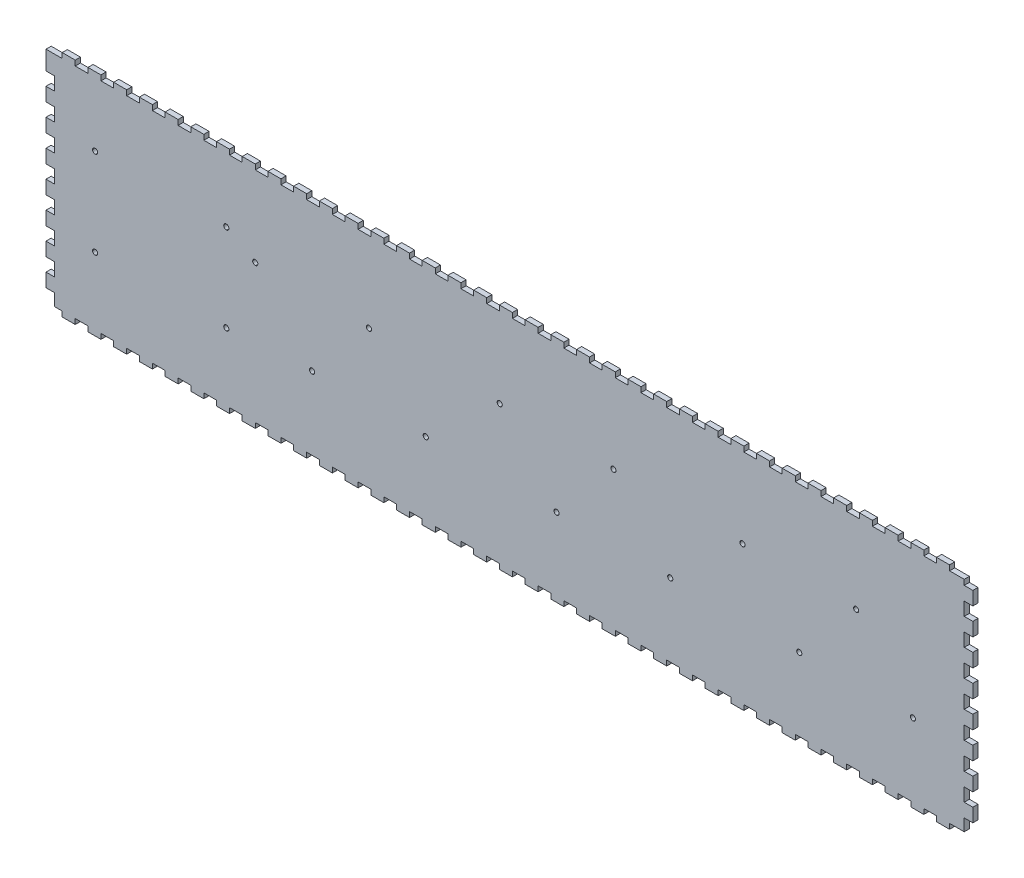
from build123d import *

# Parameters (mm, degrees)
BOSS_EXTRUDE1_DEPTH = 3


with BuildPart() as part:
    # Sketch1 → Boss-Extrude1 (new body)
    with BuildSketch(Plane.XY):
        Polygon((533.360201, 7.715942), (533.360201, 0.710022), (524.841634, 0.710022), (524.841634, -2.29), (517.27314, -2.29), (517.27314, 0.710022), (509.904684, 0.710022), (509.904684, -2.29), (502.33619, -2.29), (502.33619, 0.710022), (494.967706, 0.710022), (494.967706, -2.29), (487.471629826, -2.29), (487.326794174, 0.710022), (480.030757, 0.710022), (480.030757, -2.29), (472.462262, -2.29), (472.462262, 0.710022), (465.093779, 0.710022), (465.093779, -2.29), (457.525651, -2.29), (457.525651, 0.710022), (450.157167, 0.710022), (450.157167, -2.29), (442.588673, -2.29), (442.588673, 0.710022), (435.220218, 0.710022), (435.220218, -2.29), (427.651723, -2.29), (427.651723, 0.710022), (420.28324, 0.710022), (420.28324, -2.29), (412.714745, -2.29), (412.714745, 0.710022), (405.34629, 0.710022), (405.34629, -2.29), (397.777795, -2.29), (397.777795, 0.710022), (390.409312, 0.710022), (390.409312, -2.29), (382.840817, -2.29), (382.840817, 0.710022), (375.472701, 0.710022), (375.472701, -2.29), (367.904206, -2.29), (367.904206, 0.710022), (360.535751, 0.710022), (360.535751, -2.29), (352.967257, -2.29), (352.967257, 0.710022), (345.598773, 0.710022), (345.598773, -2.29), (338.030279, -2.29), (338.030279, 0.710022), (330.661823, 0.710022), (330.661823, -2.29), (323.093329, -2.29), (323.093329, 0.710022), (315.724845, 0.710022), (315.724845, -2.29), (308.156351, -2.29), (308.156351, 0.710022), (300.787895, 0.710022), (300.787895, -2.29), (293.21974, -2.29), (293.21974, 0.710022), (285.851284, 0.710022), (285.851284, -2.29), (278.28279, -2.29), (278.28279, 0.710022), (270.914306, 0.710022), (270.914306, -2.29), (263.345812, -2.29), (263.345812, 0.710022), (255.977357, 0.710022), (255.977357, -2.29), (248.408862, -2.29), (248.408862, 0.710022), (241.040379, 0.710022), (241.040379, -2.29), (233.471884, -2.29), (233.471884, 0.710022), (226.103429, 0.710022), (226.103429, -2.29), (218.534934, -2.29), (218.534934, 0.710022), (211.166451, 0.710022), (211.166451, -2.29), (203.598323, -2.29), (203.598323, 0.710022), (196.22984, 0.710022), (196.22984, -2.29), (188.661345, -2.29), (188.661345, 0.710022), (181.29289, 0.710022), (181.29289, -2.29), (173.724395, -2.29), (173.724395, 0.710022), (166.355912, 0.710022), (166.355912, -2.29), (158.787417, -2.29), (158.787417, 0.710022), (151.418962, 0.710022), (151.418962, -2.29), (143.850468, -2.29), (143.850468, 0.710022), (136.481984, 0.710022), (136.481984, -2.29), (128.913851, -2.29), (128.913851, 0.710022), (121.545381, 0.710022), (121.545381, -2.29), (113.976887, -2.29), (113.976887, 0.710022), (106.608418, 0.710022), (106.608418, -2.29), (99.039923, -2.29), (99.039923, 0.710022), (91.671454, 0.710022), (91.671454, -2.29), (84.102959, -2.29), (84.102959, 0.710022), (76.734526, 0.710022), (76.734526, -2.29), (69.166066, -2.29), (69.166066, 0.710022), (61.79763, 0.710022), (61.79763, -2.29), (54.229173, -2.29), (54.229173, 0.710022), (46.860703, 0.710022), (46.860703, -2.29), (39.292279, -2.29), (39.292279, 0.710022), (31.92381, 0.710022), (31.92381, -2.29), (24.355349, -2.29), (24.355349, 0.710022), (16.986916, 0.710022), (16.986916, -2.29), (9.418456, -2.29), (9.418456, 0.710022), (5.000021, 0.710022), (5.000021, 7.715942), (0, 7.715942), (0, 15.606102), (5.000021, 15.606102), (5.000021, 23.296288), (0, 23.296288), (0, 31.186448), (5.000021, 31.186448), (5.000021, 38.876637), (0, 38.876637), (0, 46.766797), (5.000021, 46.766797), (5.000021, 54.457019), (0, 54.457019), (0, 62.347179), (5.000021, 62.347188), (5.000021, 70.037365), (0, 70.037365), (0, 77.927525), (5.000021, 77.927525), (5.000021, 85.617711), (0, 85.617711), (0, 93.507905), (5.000021, 93.507905), (5.000021, 101.198094), (0, 101.198094), (0, 109.088253), (5.000021, 109.088253), (5.000021, 116.778442), (0, 116.778442), (0, 127.748999), (9.418456, 127.748999), (9.418456, 130.749021), (16.986916, 130.749021), (16.986916, 127.748999), (24.355349, 127.748999), (24.355349, 130.749021), (31.92381, 130.749021), (31.92381, 127.748999), (39.292279, 127.748999), (39.292279, 130.749021), (46.860703, 130.749021), (46.860703, 127.748999), (54.229173, 127.748999), (54.229173, 130.749021), (61.79763, 130.749021), (61.79763, 127.748999), (69.166066, 127.748999), (69.166066, 130.749021), (76.734526, 130.749021), (76.734526, 127.748999), (84.102959, 127.748999), (84.102959, 130.749021), (91.671454, 130.749021), (91.671454, 127.748999), (99.039923, 127.748999), (99.039923, 130.749021), (106.608418, 130.749021), (106.608418, 127.748999), (113.976887, 127.748999), (113.976887, 130.749021), (121.545381, 130.749021), (121.545381, 127.748999), (128.913851, 127.748999), (128.913851, 130.749021), (136.481984, 130.749021), (136.481984, 127.748999), (143.850468, 127.748999), (143.850468, 130.749021), (151.418962, 130.749021), (151.418962, 127.748999), (158.787417, 127.748999), (158.787417, 130.749021), (166.355912, 130.749021), (166.355912, 127.748999), (173.724395, 127.748999), (173.724395, 130.749021), (181.29289, 130.749021), (181.29289, 127.748999), (188.661345, 127.748999), (188.661345, 130.749021), (196.22984, 130.749021), (196.22984, 127.748999), (203.598323, 127.748999), (203.598323, 130.749021), (211.166451, 130.749021), (211.166451, 127.748999), (218.534934, 127.748999), (218.534934, 130.749021), (226.103429, 130.749021), (226.103429, 127.748999), (233.471884, 127.748999), (233.471884, 130.749021), (241.040379, 130.749021), (241.040379, 127.748999), (248.408862, 127.748999), (248.408862, 130.749021), (255.977357, 130.749021), (255.977357, 127.748999), (263.345812, 127.748999), (263.345812, 130.749021), (270.914306, 130.749021), (270.914306, 127.748999), (278.28279, 127.748999), (278.28279, 130.749021), (285.851284, 130.749021), (285.851284, 127.748999), (293.21974, 127.748999), (293.21974, 130.749021), (300.787895, 130.749021), (300.787895, 127.748999), (308.156351, 127.748999), (308.156351, 130.749021), (315.724845, 130.749021), (315.724845, 127.748999), (323.093329, 127.748999), (323.093329, 130.749021), (330.661823, 130.749021), (330.661823, 127.748999), (338.030279, 127.748999), (338.030279, 130.749021), (345.598773, 130.749021), (345.598773, 127.748999), (352.967257, 127.748999), (352.967257, 130.749021), (360.535751, 130.749021), (360.535751, 127.748999), (367.904206, 127.748999), (367.904206, 130.749021), (375.472701, 130.749021), (375.472701, 127.748999), (382.840817, 127.748999), (382.840817, 130.749021), (390.409312, 130.749021), (390.409312, 127.748999), (397.777795, 127.748999), (397.777795, 130.749021), (405.34629, 130.749021), (405.34629, 127.748999), (412.714745, 127.748999), (412.714745, 130.749021), (420.28324, 130.749021), (420.28324, 127.748999), (427.651723, 127.748999), (427.651723, 130.749021), (435.220218, 130.749021), (435.220218, 127.748999), (442.588673, 127.748999), (442.588673, 130.749021), (450.157167, 130.749021), (450.157167, 127.748999), (457.525651, 127.748999), (457.525651, 130.749021), (465.093779, 130.749021), (465.093779, 127.748999), (472.462262, 127.748999), (472.462262, 130.749021), (480.030757, 130.749021), (480.030757, 127.748999), (487.399212, 127.748999), (487.399212, 130.749021), (494.967706, 130.749021), (494.967706, 127.748999), (502.33619, 127.748999), (502.33619, 130.749021), (509.904684, 130.749021), (509.904684, 127.748999), (517.27314, 127.748999), (517.27314, 130.749021), (524.841634, 130.749021), (524.841634, 127.748999), (533.360201, 127.748999), (533.360201, 124.669342), (538.359429, 124.669342), (538.359429, 116.781877), (533.360201, 116.781877), (533.360201, 109.094314), (538.359853, 109.094314), (538.359853, 101.206848), (533.360201, 101.206848), (533.360201, 93.505726), (538.359853, 93.505726), (538.359853, 85.615733), (533.360201, 85.615733), (533.360201, 77.925739), (538.359853, 77.925739), (538.359853, 70.035782), (533.360201, 70.035782), (533.360201, 62.345791), (538.359853, 62.345791), (538.359853, 54.455831), (533.360201, 54.455831), (533.360201, 46.765803), (538.359853, 46.765803), (538.359853, 38.875844), (533.360201, 38.875844), (533.360201, 31.185853), (538.359853, 31.185853), (538.359853, 23.295893), (533.360201, 23.295893), (533.360201, 15.605902), (538.359853, 15.605902), (538.359853, 7.715942), align=None)
        with BuildLine():
            add(Edge.make_bspline(
                [(502.099744, 43.109005), (502.099744, 42.280683), (502.77108, 41.608994), (503.599755, 41.608994)],
                knots=[0, 0, 0, 0, 1, 1, 1, 1], degree=3))
            add(Edge.make_bspline(
                [(503.599755, 41.608994), (504.427725, 41.608994), (505.099766, 42.280683), (505.099766, 43.109005)],
                knots=[0, 0, 0, 0, 1, 1, 1, 1], degree=3))
            add(Edge.make_bspline(
                [(505.099766, 43.109005), (505.099766, 43.93768), (504.427725, 44.609016), (503.599755, 44.609016)],
                knots=[0, 0, 0, 0, 1, 1, 1, 1], degree=3))
            add(Edge.make_bspline(
                [(503.599755, 44.609016), (502.77108, 44.609016), (502.099744, 43.93768), (502.099744, 43.109005)],
                knots=[0, 0, 0, 0, 1, 1, 1, 1], degree=3))
        make_face(mode=Mode.SUBTRACT)
        with BuildLine():
            add(Edge.make_bspline(
                [(469.079391, 81.209005), (469.079391, 80.380683), (469.750727, 79.708994), (470.579402, 79.708994)],
                knots=[0, 0, 0, 0, 1, 1, 1, 1], degree=3))
            add(Edge.make_bspline(
                [(470.579402, 79.708994), (471.408077, 79.708994), (472.079414, 80.380683), (472.079414, 81.209005)],
                knots=[0, 0, 0, 0, 1, 1, 1, 1], degree=3))
            add(Edge.make_bspline(
                [(472.079414, 81.209005), (472.079414, 82.03768), (471.408077, 82.709016), (470.579402, 82.709016)],
                knots=[0, 0, 0, 0, 1, 1, 1, 1], degree=3))
            add(Edge.make_bspline(
                [(470.579402, 82.709016), (469.750727, 82.709016), (469.079391, 82.03768), (469.079391, 81.209005)],
                knots=[0, 0, 0, 0, 1, 1, 1, 1], degree=3))
        make_face(mode=Mode.SUBTRACT)
        with BuildLine():
            add(Edge.make_bspline(
                [(436.059779, 43.109005), (436.059779, 42.280683), (436.731115, 41.608994), (437.559438, 41.608994)],
                knots=[0, 0, 0, 0, 1, 1, 1, 1], degree=3))
            add(Edge.make_bspline(
                [(437.559438, 41.608994), (438.388113, 41.608994), (439.059449, 42.280683), (439.059449, 43.109005)],
                knots=[0, 0, 0, 0, 1, 1, 1, 1], degree=3))
            add(Edge.make_bspline(
                [(439.059449, 43.109005), (439.059449, 43.93768), (438.388113, 44.609016), (437.559438, 44.609016)],
                knots=[0, 0, 0, 0, 1, 1, 1, 1], degree=3))
            add(Edge.make_bspline(
                [(437.559438, 44.609016), (436.731115, 44.609016), (436.059779, 43.93768), (436.059779, 43.109005)],
                knots=[0, 0, 0, 0, 1, 1, 1, 1], degree=3))
        make_face(mode=Mode.SUBTRACT)
        with BuildLine():
            add(Edge.make_bspline(
                [(403.039427, 81.209005), (403.039427, 80.380683), (403.710763, 79.708994), (404.539438, 79.708994)],
                knots=[0, 0, 0, 0, 1, 1, 1, 1], degree=3))
            add(Edge.make_bspline(
                [(404.539438, 79.708994), (405.368113, 79.708994), (406.039449, 80.380683), (406.039449, 81.209005)],
                knots=[0, 0, 0, 0, 1, 1, 1, 1], degree=3))
            add(Edge.make_bspline(
                [(406.039449, 81.209005), (406.039449, 82.03768), (405.368113, 82.709016), (404.539438, 82.709016)],
                knots=[0, 0, 0, 0, 1, 1, 1, 1], degree=3))
            add(Edge.make_bspline(
                [(404.539438, 82.709016), (403.710763, 82.709016), (403.039427, 82.03768), (403.039427, 81.209005)],
                knots=[0, 0, 0, 0, 1, 1, 1, 1], degree=3))
        make_face(mode=Mode.SUBTRACT)
        with BuildLine():
            add(Edge.make_bspline(
                [(361.099822, 43.109005), (361.099822, 42.280683), (361.771158, 41.608994), (362.599833, 41.608994)],
                knots=[0, 0, 0, 0, 1, 1, 1, 1], degree=3))
            add(Edge.make_bspline(
                [(362.599833, 41.608994), (363.427802, 41.608994), (364.099844, 42.280683), (364.099844, 43.109005)],
                knots=[0, 0, 0, 0, 1, 1, 1, 1], degree=3))
            add(Edge.make_bspline(
                [(364.099844, 43.109005), (364.099844, 43.93768), (363.427802, 44.609016), (362.599833, 44.609016)],
                knots=[0, 0, 0, 0, 1, 1, 1, 1], degree=3))
            add(Edge.make_bspline(
                [(362.599833, 44.609016), (361.771158, 44.609016), (361.099822, 43.93768), (361.099822, 43.109005)],
                knots=[0, 0, 0, 0, 1, 1, 1, 1], degree=3))
        make_face(mode=Mode.SUBTRACT)
        with BuildLine():
            add(Edge.make_bspline(
                [(328.079469, 81.209005), (328.079469, 80.380683), (328.750805, 79.708994), (329.57948, 79.708994)],
                knots=[0, 0, 0, 0, 1, 1, 1, 1], degree=3))
            add(Edge.make_bspline(
                [(329.57948, 79.708994), (330.408155, 79.708994), (331.079491, 80.380683), (331.079491, 81.209005)],
                knots=[0, 0, 0, 0, 1, 1, 1, 1], degree=3))
            add(Edge.make_bspline(
                [(331.079491, 81.209005), (331.079491, 82.03768), (330.408155, 82.709016), (329.57948, 82.709016)],
                knots=[0, 0, 0, 0, 1, 1, 1, 1], degree=3))
            add(Edge.make_bspline(
                [(329.57948, 82.709016), (328.750805, 82.709016), (328.079469, 82.03768), (328.079469, 81.209005)],
                knots=[0, 0, 0, 0, 1, 1, 1, 1], degree=3))
        make_face(mode=Mode.SUBTRACT)
        with BuildLine():
            add(Edge.make_bspline(
                [(295.059465, 43.109005), (295.059465, 42.280683), (295.731154, 41.608994), (296.559476, 41.608994)],
                knots=[0, 0, 0, 0, 1, 1, 1, 1], degree=3))
            add(Edge.make_bspline(
                [(296.559476, 41.608994), (297.388155, 41.608994), (298.059491, 42.280683), (298.059491, 43.109005)],
                knots=[0, 0, 0, 0, 1, 1, 1, 1], degree=3))
            add(Edge.make_bspline(
                [(298.059491, 43.109005), (298.059491, 43.93768), (297.388155, 44.609016), (296.559476, 44.609016)],
                knots=[0, 0, 0, 0, 1, 1, 1, 1], degree=3))
            add(Edge.make_bspline(
                [(296.559476, 44.609016), (295.731154, 44.609016), (295.059465, 43.93768), (295.059465, 43.109005)],
                knots=[0, 0, 0, 0, 1, 1, 1, 1], degree=3))
        make_face(mode=Mode.SUBTRACT)
        with BuildLine():
            add(Edge.make_bspline(
                [(262.039426, 81.209005), (262.039426, 80.380683), (262.710798, 79.708994), (263.539402, 79.708994)],
                knots=[0, 0, 0, 0, 1, 1, 1, 1], degree=3))
            add(Edge.make_bspline(
                [(263.539402, 79.708994), (264.368042, 79.708994), (265.039413, 80.380683), (265.039413, 81.209005)],
                knots=[0, 0, 0, 0, 1, 1, 1, 1], degree=3))
            add(Edge.make_bspline(
                [(265.039413, 81.209005), (265.039413, 82.03768), (264.368042, 82.709016), (263.539402, 82.709016)],
                knots=[0, 0, 0, 0, 1, 1, 1, 1], degree=3))
            add(Edge.make_bspline(
                [(263.539402, 82.709016), (262.710798, 82.709016), (262.039426, 82.03768), (262.039426, 81.209005)],
                knots=[0, 0, 0, 0, 1, 1, 1, 1], degree=3))
        make_face(mode=Mode.SUBTRACT)
        with BuildLine():
            add(Edge.make_bspline(
                [(28.539436, 89.179434), (27.710761, 89.179434), (27.039425, 89.85077), (27.039425, 90.679092)],
                knots=[0, 0, 0, 0, 1, 1, 1, 1], degree=3))
            add(Edge.make_bspline(
                [(27.039425, 90.679092), (27.039425, 91.507767), (27.710761, 92.179103), (28.539436, 92.179103)],
                knots=[0, 0, 0, 0, 1, 1, 1, 1], degree=3))
            add(Edge.make_bspline(
                [(28.539436, 92.179103), (29.368111, 92.179103), (30.039447, 91.507767), (30.039447, 90.679092)],
                knots=[0, 0, 0, 0, 1, 1, 1, 1], degree=3))
            add(Edge.make_bspline(
                [(30.039447, 90.679092), (30.039447, 89.85077), (29.368111, 89.179434), (28.539436, 89.179434)],
                knots=[0, 0, 0, 0, 1, 1, 1, 1], degree=3))
        make_face(mode=Mode.SUBTRACT)
        with BuildLine():
            add(Edge.make_bspline(
                [(28.539436, 38.37834), (27.710761, 38.37834), (27.039425, 39.048618), (27.039425, 39.877646)],
                knots=[0, 0, 0, 0, 1, 1, 1, 1], degree=3))
            add(Edge.make_bspline(
                [(27.039425, 39.877646), (27.039425, 40.706673), (27.710761, 41.380479), (28.539436, 41.380479)],
                knots=[0, 0, 0, 0, 1, 1, 1, 1], degree=3))
            add(Edge.make_bspline(
                [(28.539436, 41.380479), (29.368111, 41.380479), (30.039447, 40.706673), (30.039447, 39.877646)],
                knots=[0, 0, 0, 0, 1, 1, 1, 1], degree=3))
            add(Edge.make_bspline(
                [(30.039447, 39.877646), (30.039447, 39.048618), (29.368111, 38.37834), (28.539436, 38.37834)],
                knots=[0, 0, 0, 0, 1, 1, 1, 1], degree=3))
        make_face(mode=Mode.SUBTRACT)
        with BuildLine():
            add(Edge.make_bspline(
                [(104.739471, 38.37834), (103.910796, 38.37834), (103.23946, 39.048618), (103.23946, 39.877646)],
                knots=[0, 0, 0, 0, 1, 1, 1, 1], degree=3))
            add(Edge.make_bspline(
                [(103.23946, 39.877646), (103.23946, 40.706673), (103.910796, 41.380479), (104.739471, 41.380479)],
                knots=[0, 0, 0, 0, 1, 1, 1, 1], degree=3))
            add(Edge.make_bspline(
                [(104.739471, 41.380479), (105.568146, 41.380479), (106.239483, 40.706673), (106.239483, 39.877646)],
                knots=[0, 0, 0, 0, 1, 1, 1, 1], degree=3))
            add(Edge.make_bspline(
                [(106.239483, 39.877646), (106.239483, 39.048618), (105.568146, 38.37834), (104.739471, 38.37834)],
                knots=[0, 0, 0, 0, 1, 1, 1, 1], degree=3))
        make_face(mode=Mode.SUBTRACT)
        with BuildLine():
            add(Edge.make_bspline(
                [(104.739471, 89.179434), (103.910796, 89.179434), (103.23946, 89.85077), (103.23946, 90.679092)],
                knots=[0, 0, 0, 0, 1, 1, 1, 1], degree=3))
            add(Edge.make_bspline(
                [(103.23946, 90.679092), (103.23946, 91.507767), (103.910796, 92.179103), (104.739471, 92.179103)],
                knots=[0, 0, 0, 0, 1, 1, 1, 1], degree=3))
            add(Edge.make_bspline(
                [(104.739471, 92.179103), (105.568146, 92.179103), (106.239483, 91.507767), (106.239483, 90.679092)],
                knots=[0, 0, 0, 0, 1, 1, 1, 1], degree=3))
            add(Edge.make_bspline(
                [(106.239483, 90.679092), (106.239483, 89.85077), (105.568146, 89.179434), (104.739471, 89.179434)],
                knots=[0, 0, 0, 0, 1, 1, 1, 1], degree=3))
        make_face(mode=Mode.SUBTRACT)
        with BuildLine():
            add(Edge.make_bspline(
                [(219.09982, 43.109005), (219.09982, 42.280683), (219.771157, 41.608994), (220.599832, 41.608994)],
                knots=[0, 0, 0, 0, 1, 1, 1, 1], degree=3))
            add(Edge.make_bspline(
                [(220.599832, 41.608994), (221.427801, 41.608994), (222.099843, 42.280683), (222.099843, 43.109005)],
                knots=[0, 0, 0, 0, 1, 1, 1, 1], degree=3))
            add(Edge.make_bspline(
                [(222.099843, 43.109005), (222.099843, 43.93768), (221.427801, 44.609016), (220.599832, 44.609016)],
                knots=[0, 0, 0, 0, 1, 1, 1, 1], degree=3))
            add(Edge.make_bspline(
                [(220.599832, 44.609016), (219.771157, 44.609016), (219.09982, 43.93768), (219.09982, 43.109005)],
                knots=[0, 0, 0, 0, 1, 1, 1, 1], degree=3))
        make_face(mode=Mode.SUBTRACT)
        with BuildLine():
            add(Edge.make_bspline(
                [(186.079468, 81.209005), (186.079468, 80.380683), (186.750804, 79.708994), (187.579479, 79.708994)],
                knots=[0, 0, 0, 0, 1, 1, 1, 1], degree=3))
            add(Edge.make_bspline(
                [(187.579479, 79.708994), (188.408154, 79.708994), (189.07949, 80.380683), (189.07949, 81.209005)],
                knots=[0, 0, 0, 0, 1, 1, 1, 1], degree=3))
            add(Edge.make_bspline(
                [(189.07949, 81.209005), (189.07949, 82.03768), (188.408154, 82.709016), (187.579479, 82.709016)],
                knots=[0, 0, 0, 0, 1, 1, 1, 1], degree=3))
            add(Edge.make_bspline(
                [(187.579479, 82.709016), (186.750804, 82.709016), (186.079468, 82.03768), (186.079468, 81.209005)],
                knots=[0, 0, 0, 0, 1, 1, 1, 1], degree=3))
        make_face(mode=Mode.SUBTRACT)
        with BuildLine():
            add(Edge.make_bspline(
                [(153.059464, 43.109005), (153.059464, 42.280683), (153.731153, 41.608994), (154.559475, 41.608994)],
                knots=[0, 0, 0, 0, 1, 1, 1, 1], degree=3))
            add(Edge.make_bspline(
                [(154.559475, 41.608994), (155.388154, 41.608994), (156.05949, 42.280683), (156.05949, 43.109005)],
                knots=[0, 0, 0, 0, 1, 1, 1, 1], degree=3))
            add(Edge.make_bspline(
                [(156.05949, 43.109005), (156.05949, 43.93768), (155.388154, 44.609016), (154.559475, 44.609016)],
                knots=[0, 0, 0, 0, 1, 1, 1, 1], degree=3))
            add(Edge.make_bspline(
                [(154.559475, 44.609016), (153.731153, 44.609016), (153.059464, 43.93768), (153.059464, 43.109005)],
                knots=[0, 0, 0, 0, 1, 1, 1, 1], degree=3))
        make_face(mode=Mode.SUBTRACT)
        with BuildLine():
            add(Edge.make_bspline(
                [(120.039425, 81.209005), (120.039425, 80.380683), (120.710797, 79.708994), (121.539401, 79.708994)],
                knots=[0, 0, 0, 0, 1, 1, 1, 1], degree=3))
            add(Edge.make_bspline(
                [(121.539401, 79.708994), (122.368041, 79.708994), (123.039412, 80.380683), (123.039412, 81.209005)],
                knots=[0, 0, 0, 0, 1, 1, 1, 1], degree=3))
            add(Edge.make_bspline(
                [(123.039412, 81.209005), (123.039412, 82.03768), (122.368041, 82.709016), (121.539401, 82.709016)],
                knots=[0, 0, 0, 0, 1, 1, 1, 1], degree=3))
            add(Edge.make_bspline(
                [(121.539401, 82.709016), (120.710797, 82.709016), (120.039425, 82.03768), (120.039425, 81.209005)],
                knots=[0, 0, 0, 0, 1, 1, 1, 1], degree=3))
        make_face(mode=Mode.SUBTRACT)
    extrude(amount=BOSS_EXTRUDE1_DEPTH)


solid = part.part
